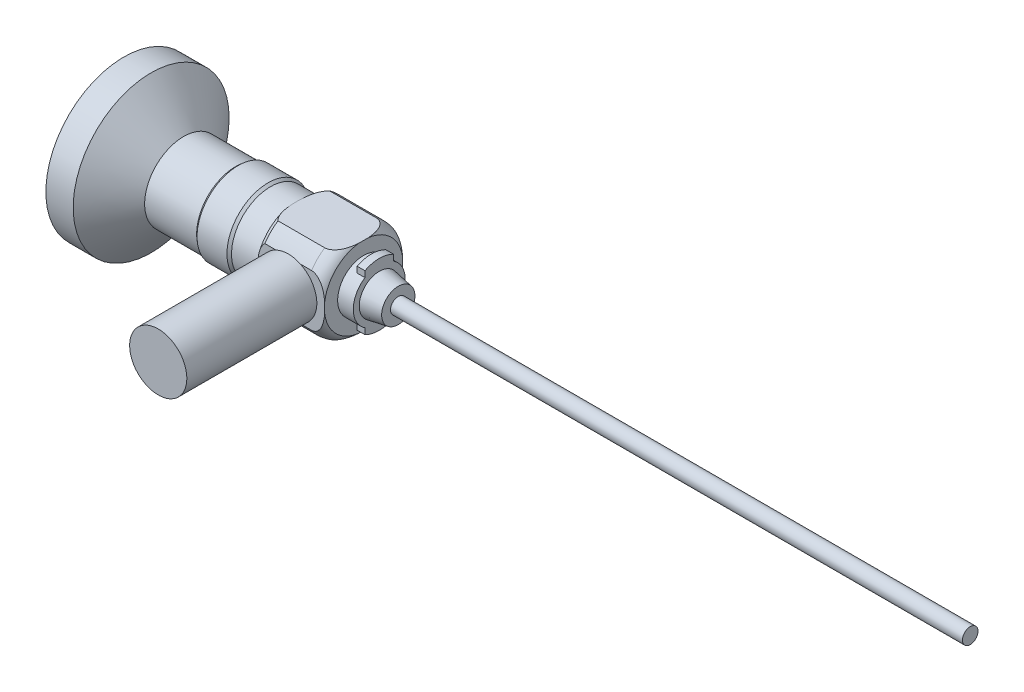
from build123d import *

# Parameters (mm, degrees)
SKETCH2_W           = 24.86541407
SKETCH2_H           = 5.423229841
SKETCH2_H_2         = 4.001260317
CUT_EXTRUDE1_DEPTH  = 15
CIRPATTERN1_COUNT   = 2
CIRPATTERN1_ANGLE   = 90
CUT_EXTRUDE2_DEPTH  = 1.5
SKETCH4_R           = 5.5
BOSS_EXTRUDE1_DEPTH = 25
SKETCH5_R           = 1.5
BOSS_EXTRUDE2_DEPTH = 110


with BuildPart() as part:
    # Sketch1 → Revolve1 (revolve)
    with BuildSketch(Plane.XY, mode=Mode.PRIVATE) as revolve1_sk:
        with BuildLine():
            ThreePointArc((-74.569724464, 0), (-75.692690434, -7.615947487), (-77.869724464, -15))
            Line((-77.869724464, -15), (-72.619724464, -15))
            Line((-72.619724464, -15), (-66.369724464, -7.5))
            Line((-66.369724464, -7.5), (-56.369724464, -7.5))
            Line((-56.369724464, -7.5), (-55.889724464, -7.9))
            Line((-55.889724464, -7.9), (-50.139724464, -7.9))
            Line((-50.139724464, -7.9), (-49.659724464, -7.5))
            Line((-49.659724464, -7.5), (-44.659724464, -7.5))
            ThreePointArc((-44.659724464, -7.5), (-44.085344133, -8.375316627), (-43.245187811, -9))
            Line((-43.245187811, -9), (-40.559724464, -9))
            Line((-40.559724464, -9), (-34.259724464, -9))
            ThreePointArc((-34.259724464, -9), (-32.817493666, -8.603076001), (-31.746136172, -7.559154808))
            Line((-31.746136172, -7.559154808), (-31.746136172, -5))
            Line((-31.746136172, -5), (-30.246136172, -5))
            Line((-30.246136172, -5), (-30.246136172, -6))
            Line((-30.246136172, -6), (-28.746136172, -6))
            Line((-28.746136172, -6), (-28.746136172, -3.85))
            Line((-28.746136172, -3.85), (-25.083482145, -3.2))
            Line((-25.083482145, -3.2), (-25.083482145, 0))
            Line((-25.083482145, 0), (-74.569724464, 0))
        make_face()
    revolve(revolve1_sk.sketch.rotate(Axis((88.99, 0, 0), (-1, 0, 0)), 270), axis=Axis((88.99, 0, 0), (-1, 0, 0)))

    # Sketch2 → Cut-Extrude1 (cut)
    with BuildSketch(Plane(origin=(-31.746136172, 0, 0), x_dir=(0, 0, -1), z_dir=(1, 0, 0))):
        with Locations((0, -10.211614921)):
            Rectangle(SKETCH2_W, SKETCH2_H)
        with Locations((0, 9.500630158)):
            Rectangle(SKETCH2_W, SKETCH2_H_2)
    cut_extrude1 = extrude(amount=-CUT_EXTRUDE1_DEPTH, mode=Mode.SUBTRACT)

    # CirPattern1: Cut-Extrude1 ×2 about axis
    cirpattern1_axis = Axis((88.99, 0, 0), (-1, 0, 0))
    for i in range(1, CIRPATTERN1_COUNT):
        add(cut_extrude1.rotate(cirpattern1_axis, i * CIRPATTERN1_ANGLE / (CIRPATTERN1_COUNT - 1)), mode=Mode.SUBTRACT)

    # Sketch3 → Cut-Extrude2 (cut)
    with BuildSketch(Plane(origin=(-28.746136172, 0, 0), x_dir=(0, 0, -1), z_dir=(1, 0, 0))):
        with BuildLine():
            Line((2.75, -4.175823272), (2.75, -6.437196595))
            Line((2.75, -6.437196595), (5.963766818, -6.437196595))
            Line((5.963766818, -6.437196595), (6.43018781, 6.437196595))
            Line((6.43018781, 6.437196595), (2.75, 6.437196595))
            Line((2.75, 6.437196595), (2.75, 4.175823272))
            ThreePointArc((2.75, 4.175823272), (5, 0), (2.75, -4.175823272))
        make_face()
        with BuildLine():
            Line((-2.75, -6.437196595), (-2.75, -4.175823272))
            ThreePointArc((-2.75, -4.175823272), (-5, 0), (-2.75, 4.175823272))
            Line((-2.75, 4.175823272), (-2.75, 6.437196595))
            Line((-2.75, 6.437196595), (-6.280612264, 6.437196595))
            Line((-6.280612264, 6.437196595), (-6.280612264, -6.437196595))
            Line((-6.280612264, -6.437196595), (-2.75, -6.437196595))
        make_face()
    extrude(amount=-CUT_EXTRUDE2_DEPTH, mode=Mode.SUBTRACT)

    # Sketch4 → Boss-Extrude1 (add)
    with BuildSketch(Plane.XY.offset(7.5)):
        with Locations(Location((-38.752456137, 0, 0), (0, 0, 244.760598179))):
            Circle(SKETCH4_R)
    extrude(amount=BOSS_EXTRUDE1_DEPTH)

    # Sketch5 → Boss-Extrude2 (add)
    with BuildSketch(Plane(origin=(-25.083482145, 0, 0), x_dir=(0, 0, -1), z_dir=(1, 0, 0))):
        with Locations(Location((0, 0, 0), (0, 0, 180))):
            Circle(SKETCH5_R)
    extrude(amount=BOSS_EXTRUDE2_DEPTH)


solid = part.part
